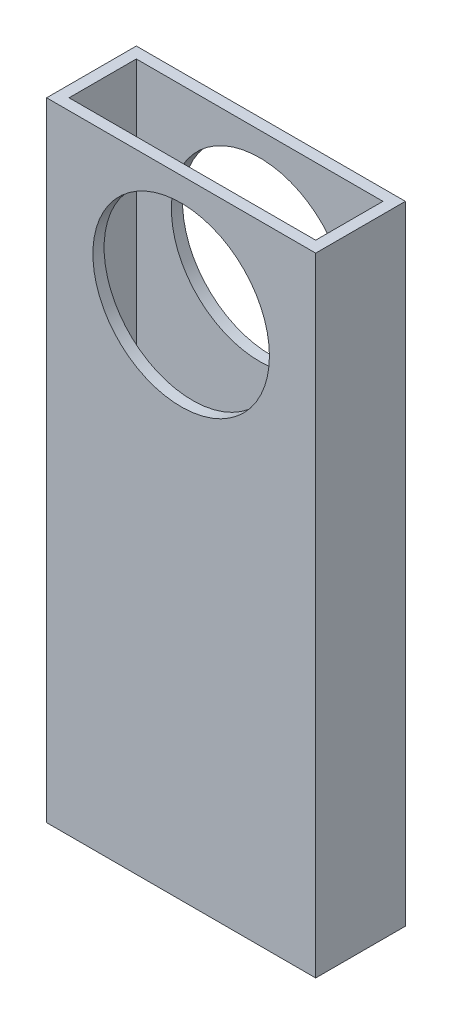
from build123d import *

# Parameters (mm, degrees)
SKETCH1_W           = 76.2
SKETCH1_H           = 25.4
SKETCH1_W_2         = 69.85
SKETCH1_H_2         = 19.05
BOSS_EXTRUDE1_DEPTH = 177.8
SKETCH2_R           = 25
CUT_EXTRUDE1_DEPTH  = 184.601770144


with BuildPart() as part:
    # Sketch1 → Boss-Extrude1 (new body)
    with BuildSketch(Plane(origin=(0, 0, 0), x_dir=(1, 0, 0), z_dir=(0, 1, 0))):
        Rectangle(SKETCH1_W, SKETCH1_H)
        Rectangle(SKETCH1_W_2, SKETCH1_H_2, mode=Mode.SUBTRACT)
    extrude(amount=BOSS_EXTRUDE1_DEPTH)

    # Sketch2 → Cut-Extrude1 (cut, through all)
    with BuildSketch(Plane.XY.offset(12.7)):
        with Locations((0, 146.05)):
            Circle(SKETCH2_R)
    extrude(amount=-CUT_EXTRUDE1_DEPTH, mode=Mode.SUBTRACT)


solid = part.part
